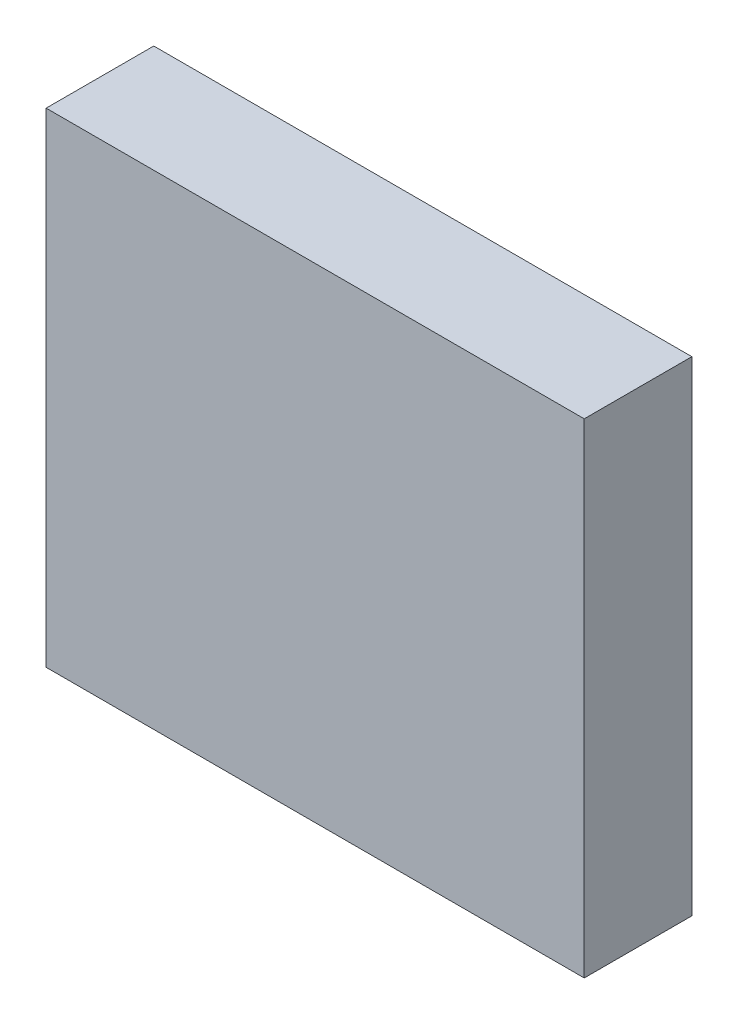
from build123d import *

# Parameters (mm, degrees)
ESQUISSE1_W        = 15
ESQUISSE1_H        = 13.5
BOSS_EXTRU_1_DEPTH = 3


with BuildPart() as part:
    # Esquisse1 → Boss.-Extru.1 (new body)
    with BuildSketch(Plane.XY):
        Rectangle(ESQUISSE1_W, ESQUISSE1_H)
    extrude(amount=BOSS_EXTRU_1_DEPTH)


solid = part.part
